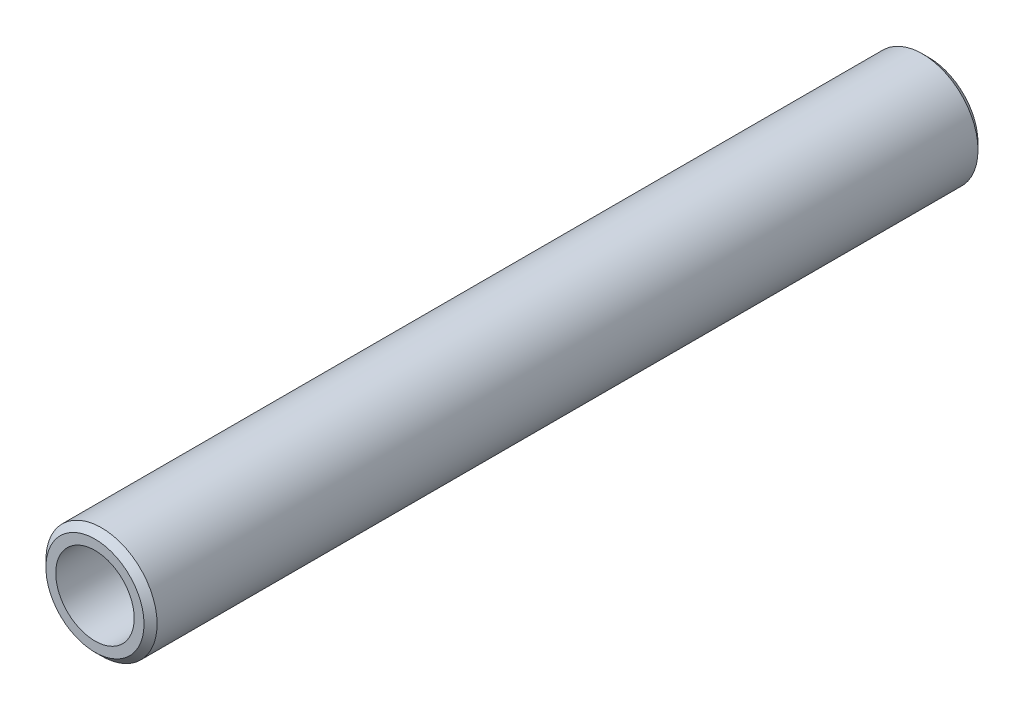
from build123d import *

# Parameters (mm, degrees)
SKETCH1_R           = 17
SKETCH1_R_2         = 12
BOSS_EXTRUDE1_DEPTH = 255
CHAMFER1_SIZE       = 2


with BuildPart() as part:
    # Sketch1 → Boss-Extrude1 (new body)
    with BuildSketch(Plane.XY):
        Circle(SKETCH1_R)
        Circle(SKETCH1_R_2, mode=Mode.SUBTRACT)
    extrude(amount=BOSS_EXTRUDE1_DEPTH)

    # Chamfer1
    chamfer1_edges = [part.edges().sort_by_distance(p)[0] for p in [
        (-17, 0, 255),
        (-17, 0, 0),
    ]]
    chamfer(chamfer1_edges, length=CHAMFER1_SIZE)


solid = part.part
